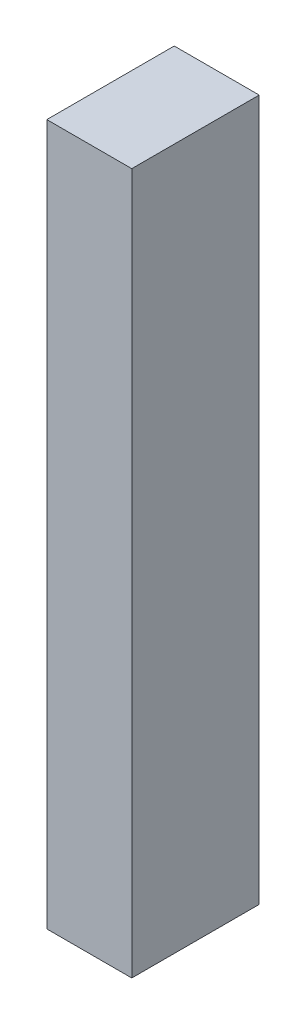
from build123d import *

# Parameters (mm, degrees)
SKETCH1_W           = 50.8
SKETCH1_H           = 76.2
BOSS_EXTRUDE1_DEPTH = 419.1


with BuildPart() as part:
    # Sketch1 → Boss-Extrude1 (new body)
    with BuildSketch(Plane(origin=(0, 0, 0), x_dir=(1, 0, 0), z_dir=(0, 1, 0))):
        Rectangle(SKETCH1_W, SKETCH1_H)
    extrude(amount=BOSS_EXTRUDE1_DEPTH)


solid = part.part
